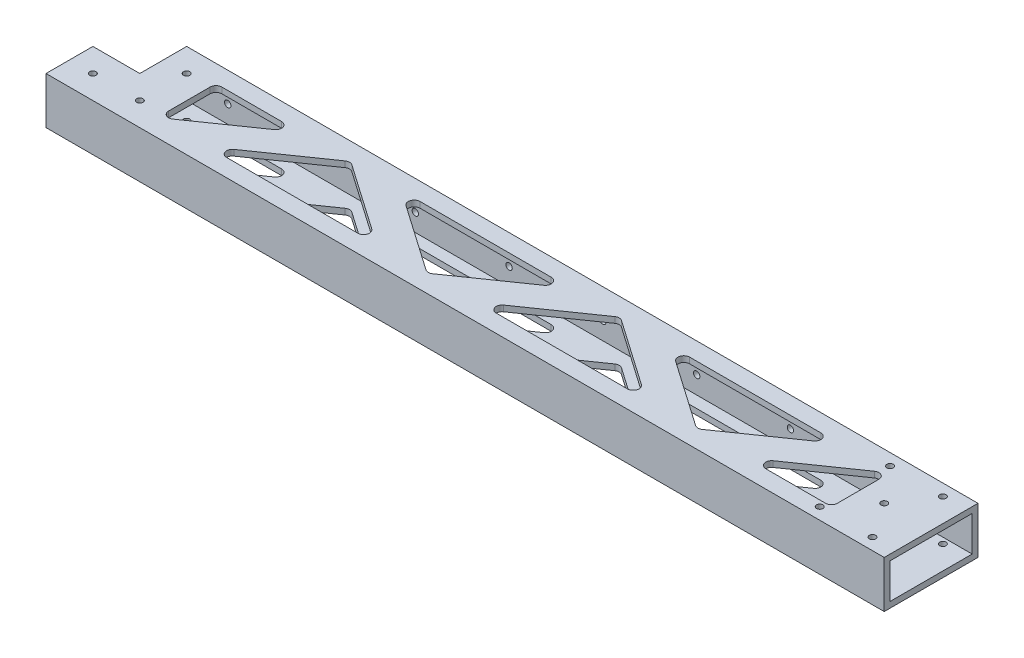
from build123d import *

# Parameters (mm, degrees)
SKETCH1_W                 = 50.8
SKETCH1_H                 = 25.4
SKETCH1_W_2               = 44.45
SKETCH1_H_2               = 19.05
BOSS_EXTRUDE1_DEPTH       = 227.0125
SKETCH2_W                 = 25.4
SKETCH2_H                 = 25.4
CUT_EXTRUDE1_DEPTH        = 230.836888154
F_8_32_TAPPED_HOLE1_D     = 3.4544
CUT_EXTRUDE2_DEPTH        = 230.836888154
FILLET1_R                 = 3.175
F_8_32_TAPPED_HOLE2_D     = 3.4544
F_8_32_TAPPED_HOLE2_DEPTH = 3.175
F_8_32_TAPPED_HOLE3_D     = 3.4544


with BuildPart() as part:
    # Sketch1 → Boss-Extrude1 (new, symmetric)
    with BuildSketch(Plane(origin=(0, 0, 0), x_dir=(0, 0, -1), z_dir=(1, 0, 0))):
        Rectangle(SKETCH1_W, SKETCH1_H)
        Rectangle(SKETCH1_W_2, SKETCH1_H_2, mode=Mode.SUBTRACT)
    extrude(amount=BOSS_EXTRUDE1_DEPTH, both=True)

    # Sketch2 → Cut-Extrude1 (cut, through all)
    with BuildSketch(Plane.XZ.offset(12.7)):
        with Locations((-214.3125, -12.7)):
            Rectangle(SKETCH2_W, SKETCH2_H)
    extrude(amount=-CUT_EXTRUDE1_DEPTH, mode=Mode.SUBTRACT)

    # #8-32 Tapped Hole1 (through all)
    with Locations(Plane(origin=(0, -12.7, 0), x_dir=(-1, 0, 0), z_dir=(0, -1, 0))):
        with Locations((-214.3125, 19.05), (-214.3125, -19.05), (-201.6125, 0), (188.9125, 12.7), (188.9125, -12.7), (214.3125, -12.7)):
            Hole(F_8_32_TAPPED_HOLE1_D / 2)

    # Sketch7 → Cut-Extrude2 (cut, through all)
    with BuildSketch(Plane(origin=(0, 12.7, 0), x_dir=(1, 0, 0), z_dir=(0, 1, 0))):
        Polygon((-176.2125, 15.875), (-130.571875, 15.875), (-176.2125, -15.875), align=None)
        Polygon((-148.828125, -15.875), (-103.1875, 15.875), (-57.546875, -15.875), align=None)
        Polygon((-75.803125, 15.875), (-30.1625, -15.875), (15.478125, 15.875), align=None)
        Polygon((42.8625, 15.875), (88.503125, -15.875), (-2.778125, -15.875), align=None)
        Polygon((70.246875, 15.875), (161.528125, 15.875), (115.8875, -15.875), align=None)
        Polygon((143.271875, -15.875), (188.9125, 15.875), (188.9125, -15.875), align=None)
    extrude(amount=-CUT_EXTRUDE2_DEPTH, mode=Mode.SUBTRACT)

    # Fillet1
    fillet1_edges = [part.edges().sort_by_distance(p)[0] for p in [
        (-176.2125, 11.1125, 15.875),
        (-176.2125, 11.1125, -15.875),
        (-130.571875, 11.1125, -15.875),
        (-176.2125, -11.1125, 15.875),
        (-176.2125, -11.1125, -15.875),
        (-130.571875, -11.1125, -15.875),
        (-57.546875, 11.1125, 15.875),
        (-148.828125, 11.1125, 15.875),
        (-103.1875, 11.1125, -15.875),
        (-57.546875, -11.1125, 15.875),
        (-148.828125, -11.1125, 15.875),
        (-103.1875, -11.1125, -15.875),
        (-75.803125, 11.1125, -15.875),
        (15.478125, 11.1125, -15.875),
        (-30.1625, 11.1125, 15.875),
        (-75.803125, -11.1125, -15.875),
        (15.478125, -11.1125, -15.875),
        (-30.1625, -11.1125, 15.875),
        (-2.778125, 11.1125, 15.875),
        (42.8625, 11.1125, -15.875),
        (88.503125, 11.1125, 15.875),
        (-2.778125, -11.1125, 15.875),
        (42.8625, -11.1125, -15.875),
        (88.503125, -11.1125, 15.875),
        (115.8875, 11.1125, 15.875),
        (70.246875, 11.1125, -15.875),
        (161.528125, 11.1125, -15.875),
        (115.8875, -11.1125, 15.875),
        (70.246875, -11.1125, -15.875),
        (161.528125, -11.1125, -15.875),
        (188.9125, 11.1125, 15.875),
        (143.271875, 11.1125, 15.875),
        (188.9125, 11.1125, -15.875),
        (188.9125, -11.1125, 15.875),
        (143.271875, -11.1125, 15.875),
        (188.9125, -11.1125, -15.875),
    ]]
    fillet(fillet1_edges, radius=FILLET1_R)

    # #8-32 Tapped Hole2
    with Locations(Plane(origin=(0, 0, -25.4), x_dir=(-1, 0, 0), z_dir=(0, 0, -1))):
        with Locations((176.2125, 0), (125.4125, 0), (74.6125, 0), (23.8125, 0), (-26.9875, 0), (-77.7875, 0), (-128.5875, 0), (-179.3875, 0)):
            Hole(F_8_32_TAPPED_HOLE2_D / 2, depth=F_8_32_TAPPED_HOLE2_DEPTH)

    # #8-32 Tapped Hole3 (through all)
    with Locations(Plane(origin=(0, 12.7, 0), x_dir=(1, 0, 0), z_dir=(0, 1, 0))):
        with Locations((185.7375, 19.05), (185.7375, -19.05)):
            Hole(F_8_32_TAPPED_HOLE3_D / 2)


solid = part.part
